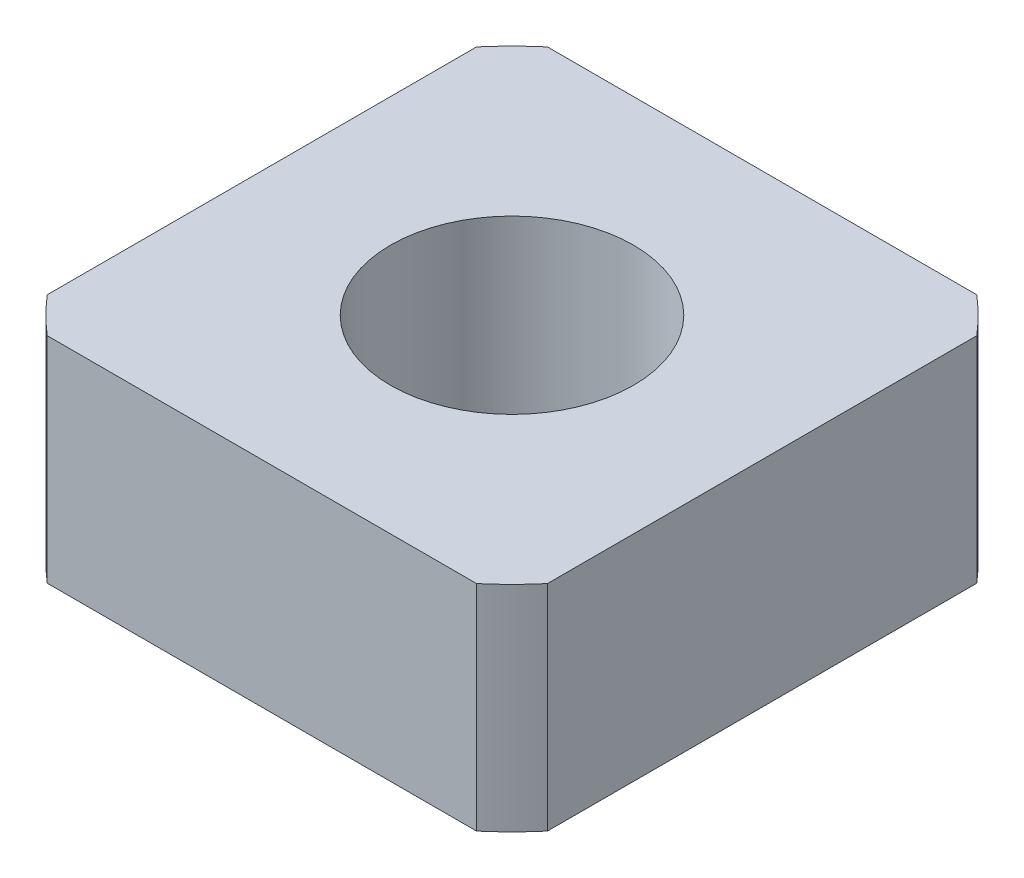
from build123d import *

# Parameters (mm, degrees)
SKETCH1_R           = 1.7
BOSS_EXTRUDE1_DEPTH = 3


with BuildPart() as part:
    # Sketch1 → Boss-Extrude1 (new body)
    with BuildSketch(Plane(origin=(0, 0, 0), x_dir=(1, 0, 0), z_dir=(0, 1, 0))):
        with BuildLine():
            Line((3.5, -3.004547628), (3.5, 3.004547628))
            ThreePointArc((3.5, 3.004547628), (3.261694839, 3.261694839), (3.004547628, 3.5))
            Line((3.004547628, 3.5), (-3.004547628, 3.5))
            ThreePointArc((-3.004547628, 3.5), (-3.261694839, 3.261694839), (-3.5, 3.004547628))
            Line((-3.5, 3.004547628), (-3.5, -3.004547628))
            ThreePointArc((-3.5, -3.004547628), (-3.261694839, -3.261694839), (-3.004547628, -3.5))
            Line((-3.004547628, -3.5), (3.004547628, -3.5))
            ThreePointArc((3.004547628, -3.5), (3.261694839, -3.261694839), (3.5, -3.004547628))
        make_face()
        with Locations(Location((0, 0, 0), (0, 0, 270))):
            Circle(SKETCH1_R, mode=Mode.SUBTRACT)
    extrude(amount=BOSS_EXTRUDE1_DEPTH)


solid = part.part
